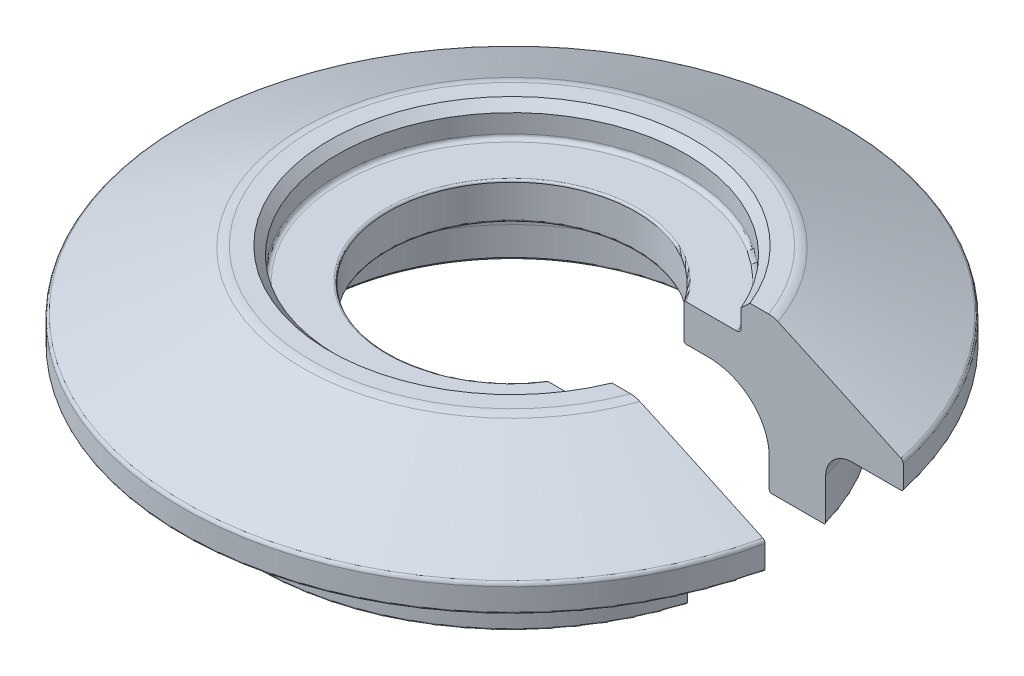
from build123d import *

# Parameters (mm, degrees)
FILLET1_R               = 0.254
CHAMFER1_SIZE           = 1.016
FILLET2_R               = 0.508
FILLET3_R               = 2.54
FILLET4_R               = 0.508
FILLET5_R               = 0.254
CUT_EXTRUDE1_DEPTH      = 60.861345484
CUT_EXTRUDE1_DEPTH_BACK = 60.861345484
SKETCH24_W              = 40.9194
SKETCH24_H              = 17.145


with BuildPart() as part:
    # Sketch23 → Revolve3 (revolve)
    with BuildSketch(Plane.XY, mode=Mode.PRIVATE) as revolve3_sk:
        with BuildLine():
            Line((15.3924, -4.572), (15.3924, 0))
            Line((15.3924, 0), (21.6535, 0))
            Line((21.6535, 0), (21.6535, 3.81))
            Line((21.6535, 3.81), (25.4, 3.81))
            Line((25.4, 3.81), (40.9194, -3.6322))
            Line((40.9194, -3.6322), (40.9194, -6.9342))
            Line((40.9194, -6.9342), (34.7345, -6.9342))
            ThreePointArc((34.7345, -6.9342), (32.48943597, -7.86413597), (31.5595, -10.1092))
            Line((31.5595, -10.1092), (31.5595, -15.3162))
            Line((31.5595, -15.3162), (24.892, -15.3162))
            Line((24.892, -15.3162), (24.892, -11.5316))
            ThreePointArc((24.892, -11.5316), (22.853580354, -6.610419646), (17.9324, -4.572))
            Line((17.9324, -4.572), (15.3924, -4.572))
        make_face()
    revolve(revolve3_sk.sketch.rotate(Axis((0, -46.909959357, 0), (0, -1, 0)), 180), axis=Axis((0, -46.909959357, 0), (0, -1, 0)))

    # Fillet1
    fillet1_edges = [part.edges().sort_by_distance(p)[0] for p in [
        (24.892, -15.3162, 0),
        (15.3924, -4.572, 0),
        (15.3924, 0, 0),
    ]]
    fillet(fillet1_edges, radius=FILLET1_R)

    # Chamfer1
    chamfer1_edges = [part.edges().sort_by_distance(p)[0] for p in [
        (21.6535, 3.81, 0),
    ]]
    chamfer(chamfer1_edges, length=CHAMFER1_SIZE)

    # Fillet2
    fillet2_edges = [part.edges().sort_by_distance(p)[0] for p in [
        (21.6535, 0, 0),
    ]]
    fillet(fillet2_edges, radius=FILLET2_R)

    # Fillet3
    fillet3_edges = [part.edges().sort_by_distance(p)[0] for p in [
        (25.4, 3.81, 0),
    ]]
    fillet(fillet3_edges, radius=FILLET3_R)

    # Fillet4
    fillet4_edges = [part.edges().sort_by_distance(p)[0] for p in [
        (40.9194, -3.6322, 0),
    ]]
    fillet(fillet4_edges, radius=FILLET4_R)

    # Fillet5
    fillet5_edges = [part.edges().sort_by_distance(p)[0] for p in [
        (40.9194, -6.9342, 0),
        (31.5595, -15.3162, 0),
    ]]
    fillet(fillet5_edges, radius=FILLET5_R)

    # Sketch24 → Cut-Extrude1 (cut, two sides: drawn at the far end of the back side and taken through both)
    with BuildSketch(Plane(origin=(0, 0, 0), x_dir=(1, 0, 0), z_dir=(0, 1, 0)).offset(-CUT_EXTRUDE1_DEPTH_BACK)):
        with Locations((20.4597, 0)):
            Rectangle(SKETCH24_W, SKETCH24_H)
    extrude(amount=CUT_EXTRUDE1_DEPTH + CUT_EXTRUDE1_DEPTH_BACK, mode=Mode.SUBTRACT)


solid = part.part
